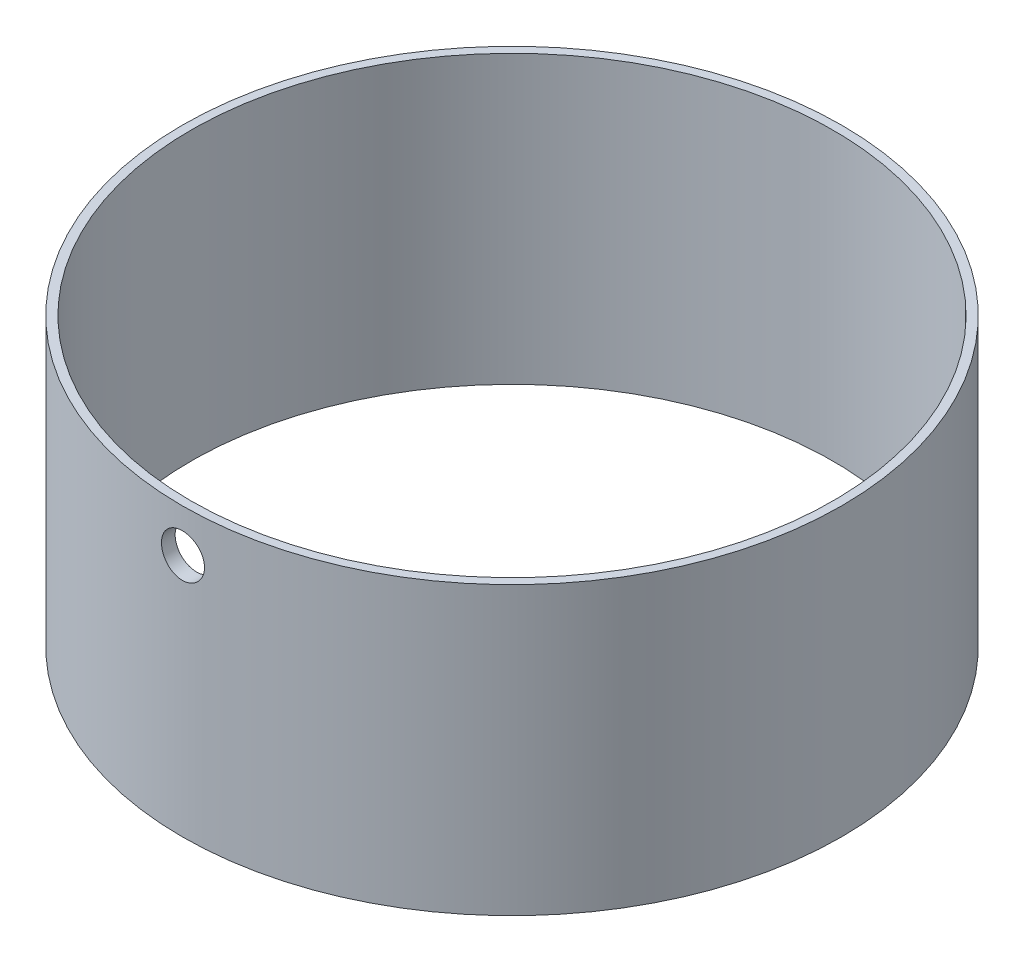
from build123d import *

# Parameters (mm, degrees)
SKETCH2_R           = 115
BOSS_EXTRUDE3_DEPTH = 100
SKETCH3_R           = 112
CUT_EXTRUDE4_DEPTH  = 191.91883092
SKETCH4_R           = 7.5
CUT_EXTRUDE5_DEPTH  = 272.753564834
SKETCH6_W           = 24
SKETCH6_H           = 26
BOSS_EXTRUDE4_DEPTH = 2
SKETCH7_R           = 7.5
CUT_EXTRUDE6_DEPTH  = 272.753564996


with BuildPart() as part:
    # Sketch2 → Boss-Extrude3 (new body)
    with BuildSketch(Plane(origin=(0, 0, 0), x_dir=(1, 0, 0), z_dir=(0, 1, 0))):
        with Locations(Location((0, 0, 0), (0, 0, 270))):
            Circle(SKETCH2_R)
    extrude(amount=BOSS_EXTRUDE3_DEPTH)

    # Sketch3 → Cut-Extrude4 (cut, through all)
    with BuildSketch(Plane(origin=(0, 100, 0), x_dir=(1, 0, 0), z_dir=(0, 1, 0))):
        with Locations(Location((0, 0, 0), (0, 0, 270))):
            Circle(SKETCH3_R)
    extrude(amount=-CUT_EXTRUDE4_DEPTH, mode=Mode.SUBTRACT)

    # Sketch4 → Cut-Extrude5 (cut, through all)
    with BuildSketch(Plane.XY.offset(110)):
        with Locations(Location((0, 85, 0), (0, 0, 90))):
            Circle(SKETCH4_R)
    extrude(amount=CUT_EXTRUDE5_DEPTH, mode=Mode.SUBTRACT)

    # Sketch6 → Boss-Extrude4 (add)
    with BuildSketch(Plane.XY.offset(110)):
        with Locations((0.188638026, 82)):
            Rectangle(SKETCH6_W, SKETCH6_H)
    extrude(amount=BOSS_EXTRUDE4_DEPTH)

    # Sketch7 → Cut-Extrude6 (cut, through all)
    with BuildSketch(Plane(origin=(0, 0, 110), x_dir=(-1, 0, 0), z_dir=(0, 0, -1))):
        with Locations((0, 85)):
            Circle(SKETCH7_R)
    extrude(amount=-CUT_EXTRUDE6_DEPTH, mode=Mode.SUBTRACT)


solid = part.part
